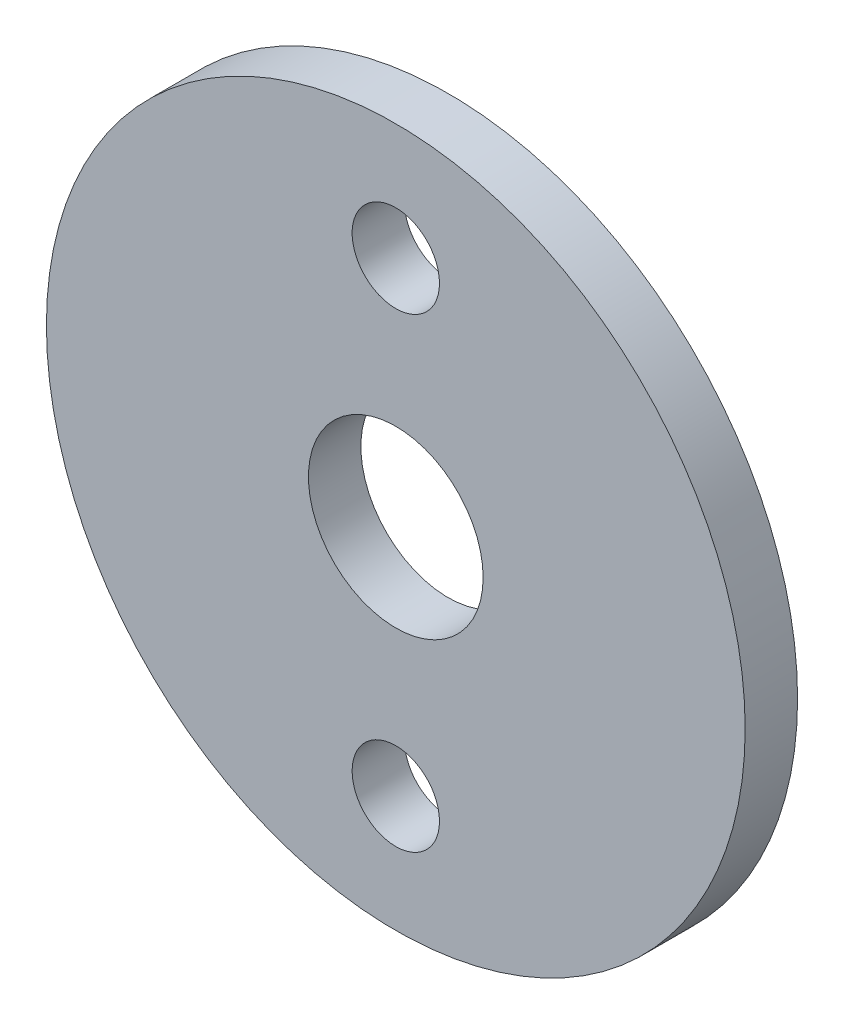
from build123d import *

# Parameters (mm, degrees)
ESQUISSE1_R             = 12
ESQUISSE1_R_2           = 3
BOSS_EXTRU_1_DEPTH      = 1.8
ENL_V_MAT_EXTRU_1_REACH = 19.066
ESQUISSE2_R             = 1.5


with BuildPart() as part:
    # Esquisse1 → Boss.-Extru.1 (new body)
    with BuildSketch(Plane.XY):
        Circle(ESQUISSE1_R)
        Circle(ESQUISSE1_R_2, mode=Mode.SUBTRACT)
    extrude(amount=BOSS_EXTRU_1_DEPTH)

    # Esquisse2 → Enlèv. mat.-Extru.1 (cut, up to next)
    with BuildSketch(Plane.XY.offset(1.8), mode=Mode.PRIVATE) as enl_v_mat_extru_1_sk1:
        with Locations((0, 8)):
            Circle(ESQUISSE2_R)
    enl_v_mat_extru_1_tool1 = extrude(enl_v_mat_extru_1_sk1.sketch, amount=-ENL_V_MAT_EXTRU_1_REACH, mode=Mode.PRIVATE) & part.part
    # Esquisse2 → Enlèv. mat.-Extru.1 (cut, up to next)
    with BuildSketch(Plane.XY.offset(1.8), mode=Mode.PRIVATE) as enl_v_mat_extru_1_sk2:
        with Locations((0, -8)):
            Circle(ESQUISSE2_R)
    enl_v_mat_extru_1_tool2 = extrude(enl_v_mat_extru_1_sk2.sketch, amount=-ENL_V_MAT_EXTRU_1_REACH, mode=Mode.PRIVATE) & part.part
    add(enl_v_mat_extru_1_tool1.solids().sort_by_distance((0, 8, 1.8))[0], mode=Mode.SUBTRACT)
    add(enl_v_mat_extru_1_tool2.solids().sort_by_distance((0, -8, 1.8))[0], mode=Mode.SUBTRACT)


solid = part.part
